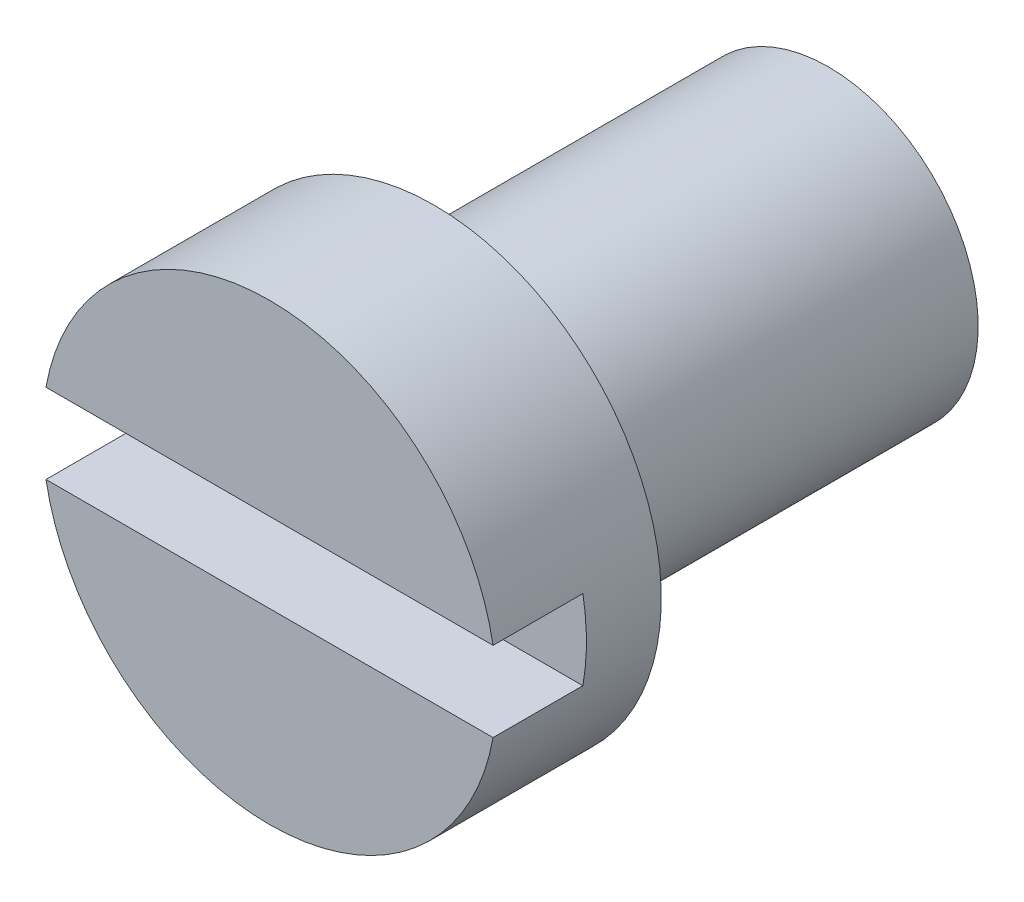
from build123d import *

# Parameters (mm, degrees)
SKETCH_2_W          = 11.343097154
SKETCH_2_H          = 1.6
CUT_EXTRUDE_1_DEPTH = 1.8


with BuildPart() as part:
    # 스케치1 → 회전1 (revolve)
    with BuildSketch(Plane(origin=(0, 0, 0), x_dir=(0, 0, -1), z_dir=(1, 0, 0))):
        Polygon((0, 0), (0, 4.55), (3.3, 4.55), (3.3, 3), (11.2, 3), (11.2, 0), align=None)
    revolve(axis=Axis((0, 0, -11.2), (0, 0, 1)))

    # 스케치2 → 컷-돌출1 (cut)
    with BuildSketch(Plane.XY):
        with Locations((-0.136663821, 0)):
            Rectangle(SKETCH_2_W, SKETCH_2_H)
    extrude(amount=-CUT_EXTRUDE_1_DEPTH, mode=Mode.SUBTRACT)


solid = part.part
